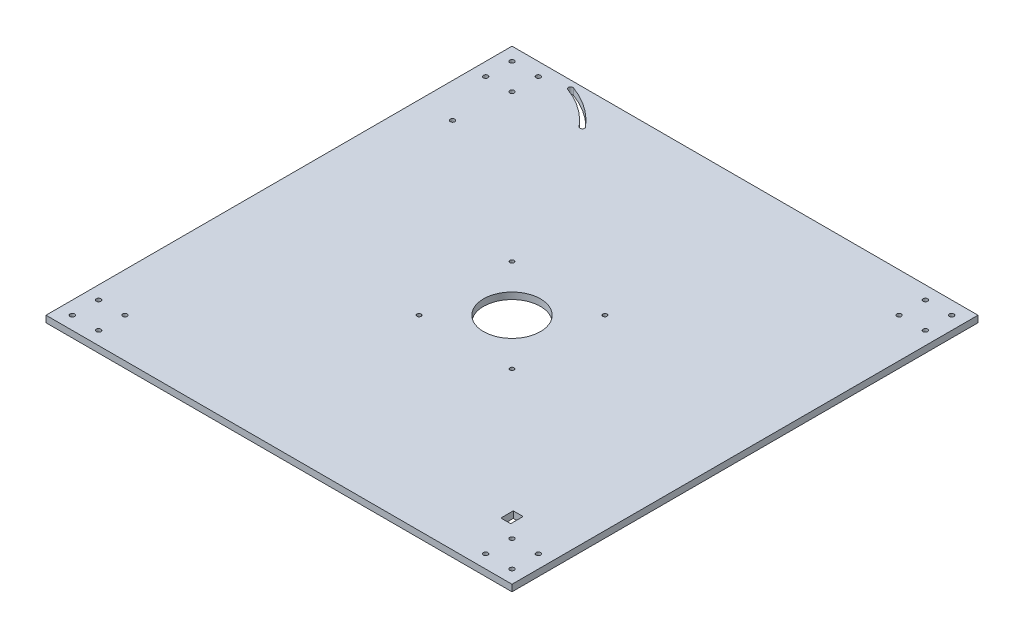
from build123d import *

# Parameters (mm, degrees)
SKETCH1_W               = 449.58
SKETCH1_H               = 449.58
BOSS_EXTRUDE1_DEPTH     = 6.35
CUT_EXTRUDE1_DEPTH      = 318.964480249
CUT_EXTRUDE1_DEPTH_BACK = 318.964480249
SKETCH2_R               = 1.984375
SKETCH2_R_2             = 27.432
SKETCH3_W               = 9.5
SKETCH3_H               = 12
CUT_EXTRUDE2_DEPTH      = 318.964480249
SKETCH4_R               = 2.1828125
CUT_EXTRUDE3_DEPTH      = 318.964480249
SKETCH5_R               = 2.1828125
CUT_EXTRUDE4_DEPTH      = 318.964480249


with BuildPart() as part:
    # Sketch1 → Boss-Extrude1 (new body)
    with BuildSketch(Plane(origin=(0, 0, 0), x_dir=(1, 0, 0), z_dir=(0, 1, 0))):
        Rectangle(SKETCH1_W, SKETCH1_H)
    extrude(amount=BOSS_EXTRUDE1_DEPTH)

    # Sketch2 → Cut-Extrude1 (cut, two sides: drawn at the far end of the back side and taken through both)
    with BuildSketch(Plane(origin=(0, 6.35, 0), x_dir=(1, 0, 0), z_dir=(0, 1, 0)).offset(-CUT_EXTRUDE1_DEPTH_BACK)):
        with Locations(Location((-44.8437, 44.8437, 0), (0, 0, 270))):
            Circle(SKETCH2_R)
        with Locations(Location((44.8437, 44.8437, 0), (0, 0, 270))):
            Circle(SKETCH2_R)
        with Locations(Location((-44.8437, -44.8437, 0), (0, 0, 270))):
            Circle(SKETCH2_R)
        with Locations(Location((44.8437, -44.8437, 0), (0, 0, 270))):
            Circle(SKETCH2_R)
        with Locations(Location((0, 0, 0), (0, 0, 270))):
            Circle(SKETCH2_R_2)
    extrude(amount=CUT_EXTRUDE1_DEPTH + CUT_EXTRUDE1_DEPTH_BACK, mode=Mode.SUBTRACT)

    # Sketch3 → Cut-Extrude2 (cut, through all)
    with BuildSketch(Plane(origin=(0, 6.35, 0), x_dir=(1, 0, 0), z_dir=(0, 1, 0))):
        with Locations((168.828815076, -168.828815076)):
            Rectangle(SKETCH3_W, SKETCH3_H)
    extrude(amount=-CUT_EXTRUDE2_DEPTH, mode=Mode.SUBTRACT)

    # Sketch4 → Cut-Extrude3 (cut, through all)
    with BuildSketch(Plane(origin=(0, 6.35, 0), x_dir=(1, 0, 0), z_dir=(0, 1, 0))):
        with Locations(Location((-212.09, 212.09, 0), (0, 0, 270))):
            Circle(SKETCH4_R)
        with Locations(Location((-186.69, 212.09, 0), (0, 0, 270))):
            Circle(SKETCH4_R)
        with Locations(Location((-212.09, 186.69, 0), (0, 0, 270))):
            Circle(SKETCH4_R)
        with Locations(Location((-186.69, 186.69, 0), (0, 0, 270))):
            Circle(SKETCH4_R)
        with Locations(Location((186.69, 212.09, 0), (0, 0, 270))):
            Circle(SKETCH4_R)
        with Locations(Location((186.69, 186.69, 0), (0, 0, 270))):
            Circle(SKETCH4_R)
        with Locations(Location((212.09, 186.69, 0), (0, 0, 270))):
            Circle(SKETCH4_R)
        with Locations(Location((212.09, 212.09, 0), (0, 0, 270))):
            Circle(SKETCH4_R)
        with Locations(Location((186.69, -186.69, 0), (0, 0, 270))):
            Circle(SKETCH4_R)
        with Locations(Location((212.09, -186.69, 0), (0, 0, 270))):
            Circle(SKETCH4_R)
        with Locations(Location((212.09, -212.09, 0), (0, 0, 270))):
            Circle(SKETCH4_R)
        with Locations(Location((186.69, -212.09, 0), (0, 0, 270))):
            Circle(SKETCH4_R)
        with Locations(Location((-212.09, -186.69, 0), (0, 0, 270))):
            Circle(SKETCH4_R)
        with Locations(Location((-186.69, -186.69, 0), (0, 0, 270))):
            Circle(SKETCH4_R)
        with Locations(Location((-186.69, -212.09, 0), (0, 0, 270))):
            Circle(SKETCH4_R)
        with Locations(Location((-212.09, -212.09, 0), (0, 0, 270))):
            Circle(SKETCH4_R)
    extrude(amount=-CUT_EXTRUDE3_DEPTH, mode=Mode.SUBTRACT)

    # Sketch5 → Cut-Extrude4 (cut, through all)
    with BuildSketch(Plane(origin=(0, 6.35, 0), x_dir=(1, 0, 0), z_dir=(0, 1, 0))):
        with Locations(Location((-191.419449709, 134.033341647, 0), (0, 0, 270))):
            Circle(SKETCH5_R)
        with BuildLine():
            ThreePointArc((-121.64596733, 192.580244977), (-139.176494703, 208.644013705), (-160.267293124, 219.623188433))
            ThreePointArc((-160.267293124, 219.623188433), (-163.065031767, 218.318581478), (-161.760424812, 215.520842836))
            ThreePointArc((-161.760424812, 215.520842836), (-141.680514333, 205.067903062), (-124.990230102, 189.774075318))
            ThreePointArc((-124.990230102, 189.774075318), (-121.915013887, 189.505028762), (-121.64596733, 192.580244977))
        make_face()
    extrude(amount=-CUT_EXTRUDE4_DEPTH, mode=Mode.SUBTRACT)


solid = part.part
